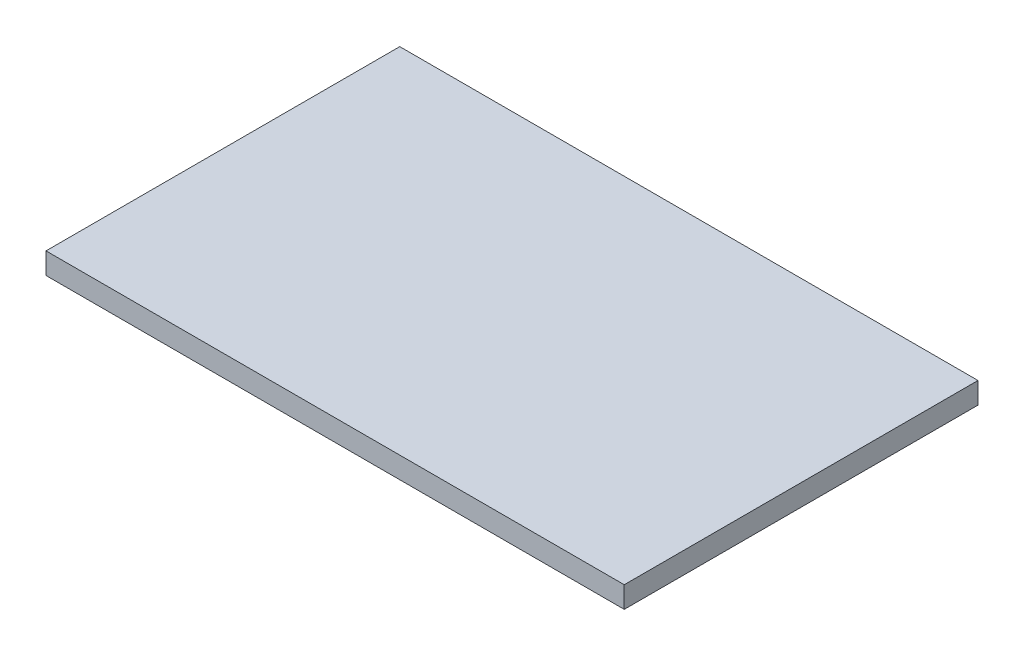
from build123d import *

# Parameters (mm, degrees)
SKETCH1_W           = 321.773804
SKETCH1_H           = 196.85
BOSS_EXTRUDE1_DEPTH = 11.8872


with BuildPart() as part:
    # Sketch1 → Boss-Extrude1 (new body)
    with BuildSketch(Plane(origin=(0, 0, 0), x_dir=(1, 0, 0), z_dir=(0, 1, 0))):
        Rectangle(SKETCH1_W, SKETCH1_H)
    extrude(amount=BOSS_EXTRUDE1_DEPTH)


solid = part.part
